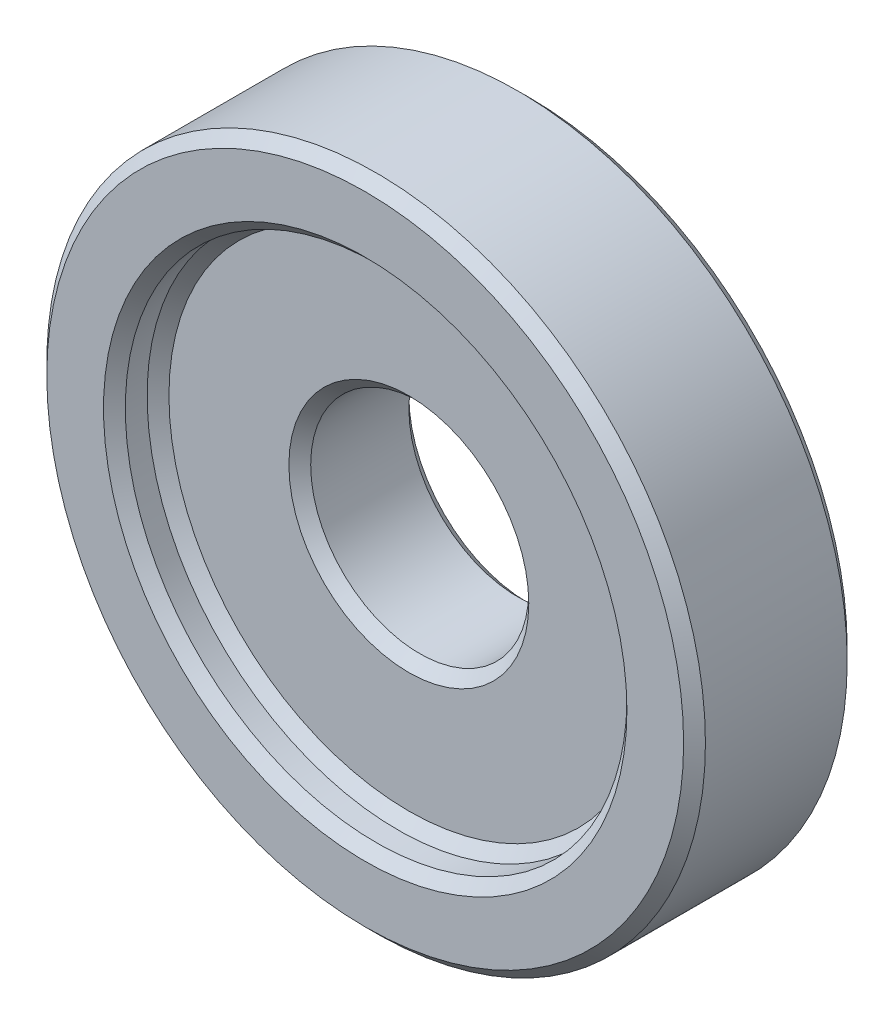
from build123d import *

# Parameters (mm, degrees)
SKETCH2_R           = 15.1
SKETCH2_R_2         = 5
BOSS_EXTRUDE1_DEPTH = 7.5
SKETCH3_R           = 11.5
CUT_EXTRUDE1_DEPTH  = 2
CHAMFER1_SIZE       = 0.5


with BuildPart() as part:
    # Sketch2 → Boss-Extrude1 (new body)
    with BuildSketch(Plane.XY):
        Circle(SKETCH2_R)
        Circle(SKETCH2_R_2, mode=Mode.SUBTRACT)
    extrude(amount=BOSS_EXTRUDE1_DEPTH)

    # Sketch3 → Cut-Extrude1 (cut)
    with BuildSketch(Plane.XY.offset(7.5)):
        Circle(SKETCH3_R)
    extrude(amount=-CUT_EXTRUDE1_DEPTH, mode=Mode.SUBTRACT)

    # Chamfer1
    chamfer1_edges = [part.edges().sort_by_distance(p)[0] for p in [
        (-11.5, 0, 5.5),
        (-5, 0, 5.5),
        (-11.5, 0, 7.5),
        (-15.1, 0, 0),
        (-15.1, 0, 7.5),
        (-5, 0, 0),
    ]]
    chamfer(chamfer1_edges, length=CHAMFER1_SIZE)


solid = part.part
